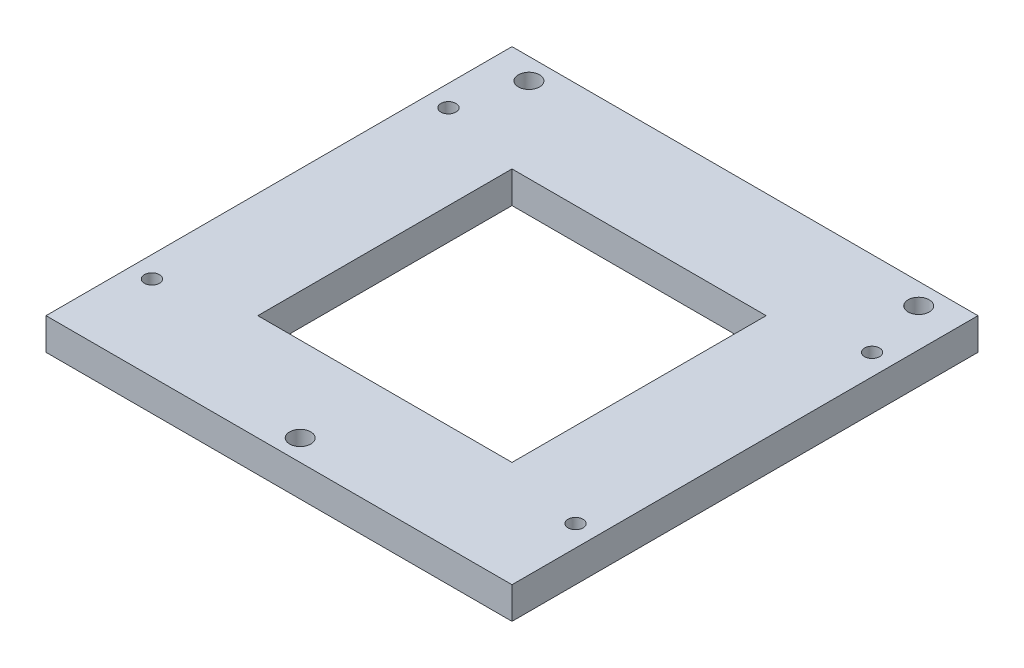
from build123d import *

# Parameters (mm, degrees)
SKETCH1_W                    = 69.85
SKETCH1_H                    = 69.85
BOSS_EXTRUDE1_DEPTH          = 2.38125
CUT_EXTRUDE1_REACH           = 51.62
SKETCH2_W                    = 38.1
SKETCH2_H                    = 38.1
F_4_40_TAPPED_HOLE1_D        = 2.2606
F_1_8_0_125_DIAMETER_HOLE1_D = 3.175


with BuildPart() as part:
    # Sketch1 → Boss-Extrude1 (new, symmetric)
    with BuildSketch(Plane(origin=(0, 0, 0), x_dir=(1, 0, 0), z_dir=(0, 1, 0))):
        Rectangle(SKETCH1_W, SKETCH1_H)
    extrude(amount=BOSS_EXTRUDE1_DEPTH, both=True)

    # Sketch2 → Cut-Extrude1 (cut, up to next)
    with BuildSketch(Plane(origin=(0, 2.38125, 0), x_dir=(1, 0, 0), z_dir=(0, 1, 0)), mode=Mode.PRIVATE) as cut_extrude1_sk1:
        Rectangle(SKETCH2_W, SKETCH2_H)
    cut_extrude1_tool1 = extrude(cut_extrude1_sk1.sketch, amount=-CUT_EXTRUDE1_REACH, mode=Mode.PRIVATE) & part.part
    add(cut_extrude1_tool1.solids().sort_by_distance((0, 2.38125, 0))[0], mode=Mode.SUBTRACT)

    # #4-40 Tapped Hole1 (through all)
    with Locations(Plane(origin=(0, 2.38125, 0), x_dir=(1, 0, 0), z_dir=(0, 1, 0))):
        with Locations((-31.75, 22.225), (31.75, 22.225)):
            f_4_40_tapped_hole1 = Hole(F_4_40_TAPPED_HOLE1_D / 2)

    # 1/8 (0.125) Diameter Hole1 (through all)
    with Locations(Plane(origin=(0, 2.38125, 0), x_dir=(1, 0, 0), z_dir=(0, 1, 0))):
        with Locations((-29.21, 31.75), (29.21, 31.75), (0, -31.75)):
            Hole(F_1_8_0_125_DIAMETER_HOLE1_D / 2)

    # Mirror1: #4-40 Tapped Hole1 across plane
    add(f_4_40_tapped_hole1.mirror(Plane.XY), mode=Mode.SUBTRACT)


solid = part.part
